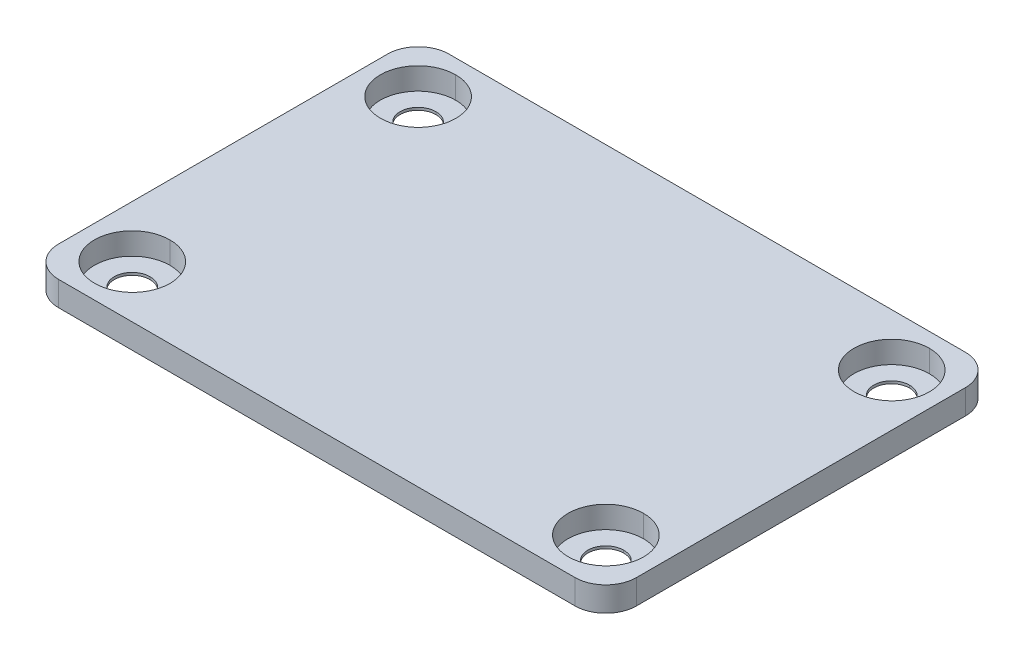
from build123d import *

# Parameters (mm, degrees)
SKETCH1_W                                    = 94
SKETCH1_H                                    = 63.5
BOSS_EXTRUDE1_DEPTH                          = 4
CBORE_SLOT_FOR_M5_HEX_HEAD_BOLT1_D           = 5.8
CBORE_SLOT_FOR_M5_HEX_HEAD_BOLT1_DEPTH       = 18
CBORE_SLOT_FOR_M5_HEX_HEAD_BOLT1_CBORE_D     = 12.24
CBORE_SLOT_FOR_M5_HEX_HEAD_BOLT1_CBORE_DEPTH = 3.58
CBORE_SLOT_FOR_M5_HEX_HEAD_BOLT1_TIP         = 1.742495795
FILLET1_R                                    = 5


with BuildPart() as part:
    # Sketch1 → Boss-Extrude1 (new body)
    with BuildSketch(Plane(origin=(0, 0, 0), x_dir=(1, 0, 0), z_dir=(0, 1, 0))):
        with Locations((12.203186111, 24.532883045)):
            Rectangle(SKETCH1_W, SKETCH1_H)
    extrude(amount=BOSS_EXTRUDE1_DEPTH)

    # CBORE SLOT for M5 Hex Head Bolt1
    with Locations(Plane(origin=(0, 4, 0), x_dir=(1, 0, 0), z_dir=(0, 1, 0))):
        with Locations((-26.296813889, 47.782883045), (-26.296813889, 1.282883045), (50.753186111, 47.782883045), (50.753186111, 1.282883045), (-26.346813889, 47.782883045), (-26.346813889, 1.282883045), (50.703186111, 1.282883045), (50.703186111, 47.782883045)):
            CounterBoreHole(CBORE_SLOT_FOR_M5_HEX_HEAD_BOLT1_D / 2, CBORE_SLOT_FOR_M5_HEX_HEAD_BOLT1_CBORE_D / 2, CBORE_SLOT_FOR_M5_HEX_HEAD_BOLT1_CBORE_DEPTH, depth=CBORE_SLOT_FOR_M5_HEX_HEAD_BOLT1_DEPTH)
            with Locations((0, 0, -(CBORE_SLOT_FOR_M5_HEX_HEAD_BOLT1_DEPTH + CBORE_SLOT_FOR_M5_HEX_HEAD_BOLT1_TIP / 2))):  # 118° drill point
                Cone(0, CBORE_SLOT_FOR_M5_HEX_HEAD_BOLT1_D / 2, CBORE_SLOT_FOR_M5_HEX_HEAD_BOLT1_TIP, mode=Mode.SUBTRACT)

    # Fillet1
    fillet1_edges = [part.edges().sort_by_distance(p)[0] for p in [
        (-34.796813889, 2, -56.282883045),
        (59.203186111, 2, -56.282883045),
        (59.203186111, 2, 7.217116955),
        (-34.796813889, 2, 7.217116955),
    ]]
    fillet(fillet1_edges, radius=FILLET1_R)


solid = part.part
